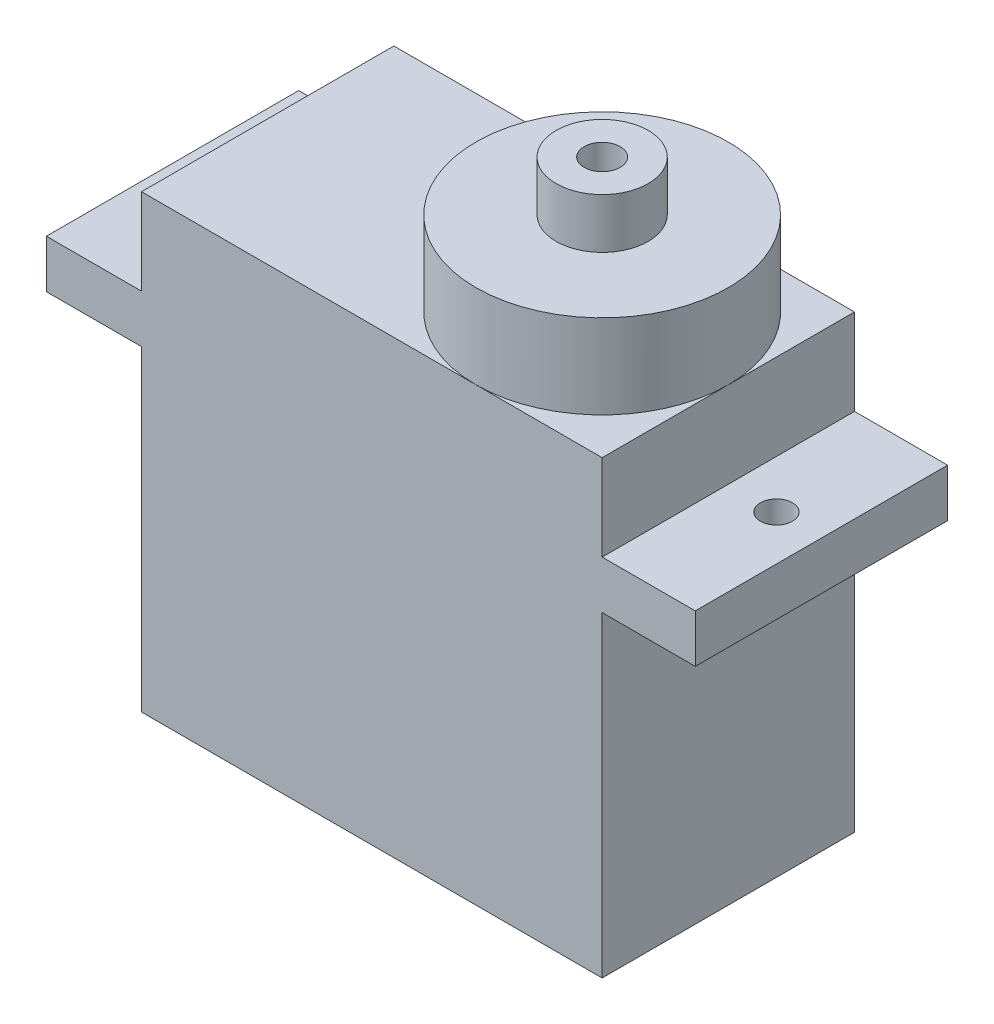
from build123d import *

# Parameters (mm, degrees)
SKETCH_5_W          = 23
SKETCH_5_H          = 22.5
EXTRUDE_4_DEPTH     = 12.6
SKETCH_6_W          = 32.4
SKETCH_6_H          = 2.4
EXTRUDE_5_DEPTH     = 12.6
SKETCH_7_R          = 6.3
EXTRUDE_6_DEPTH     = 4.2
SKETCH_9_R          = 2.3
EXTRUDE_8_DEPTH     = 2.5
SKETCH_10_R         = 0.9
CUT_EXTRUDE_1_DEPTH = 2.5
M2X0_4_1_D          = 1.6


with BuildPart() as part:
    # ｽｹｯﾁ5 → ﾎﾞｽ - 押し出し4 (new body)
    with BuildSketch(Plane.XY):
        Rectangle(SKETCH_5_W, SKETCH_5_H)
    extrude(amount=EXTRUDE_4_DEPTH)

    # ｽｹｯﾁ6 → ﾎﾞｽ - 押し出し5 (add)
    with BuildSketch(Plane.XY):
        with Locations((-0.05, 5.75)):
            Rectangle(SKETCH_6_W, SKETCH_6_H)
    extrude(amount=EXTRUDE_5_DEPTH)

    # ｽｹｯﾁ7 → ﾎﾞｽ - 押し出し6 (add)
    with BuildSketch(Plane(origin=(0, 11.25, 0), x_dir=(1, 0, 0), z_dir=(0, 1, 0))):
        with Locations(Location((5.2, -6.3, 0), (0, 0, 270))):
            Circle(SKETCH_7_R)
    extrude(amount=EXTRUDE_6_DEPTH)

    # ｽｹｯﾁ9 → ﾎﾞｽ - 押し出し8 (add)
    with BuildSketch(Plane(origin=(0, 15.45, 0), x_dir=(1, 0, 0), z_dir=(0, 1, 0))):
        with Locations(Location((5.2, -6.3, 0), (0, 0, 270))):
            Circle(SKETCH_9_R)
    extrude(amount=EXTRUDE_8_DEPTH)

    # ｽｹｯﾁ10 → ｶｯﾄ - 押し出し1 (cut)
    with BuildSketch(Plane(origin=(0, 15.45, 0), x_dir=(1, 0, 0), z_dir=(0, 1, 0))):
        with Locations(Location((5.2, -6.3, 0), (0, 0, 270))):
            Circle(SKETCH_10_R)
    extrude(amount=CUT_EXTRUDE_1_DEPTH, mode=Mode.SUBTRACT)

    # M2x0.4 ねじ穴1 (through all)
    with Locations(Plane(origin=(0, 6.95, 0), x_dir=(1, 0, 0), z_dir=(0, 1, 0))):
        with Locations((-13.9, -6.3), (13.9, -6.3)):
            Hole(M2X0_4_1_D / 2)


solid = part.part
